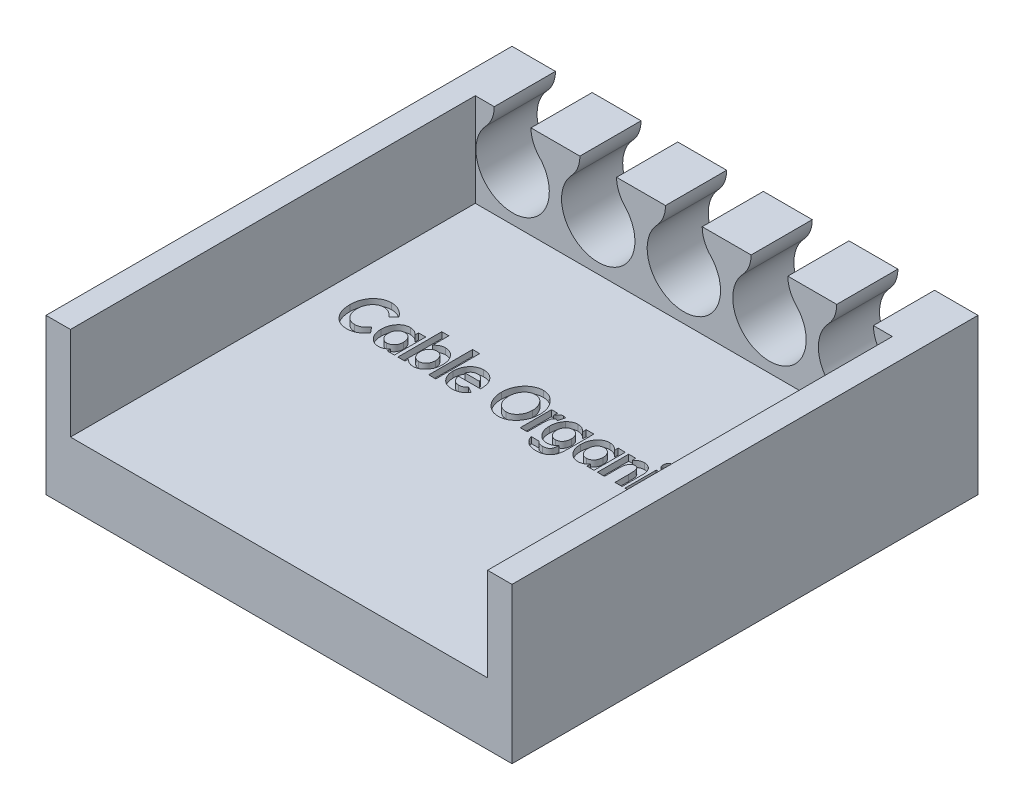
from build123d import *

# Parameters (mm, degrees)
SKETCH1_W           = 38.1
SKETCH1_H           = 38.1
BOSS_EXTRUDE1_DEPTH = 12.7
SKETCH2_W           = 34.1
SKETCH2_H           = 33.1
CUT_EXTRUDE1_DEPTH  = 7.62
CUT_EXTRUDE2_DEPTH  = 45.45
SKETCH5_W           = 0.583333333
SKETCH5_H           = 2.557692308
SKETCH5_W_2         = 0.583333334
SKETCH5_H_2         = 3.58974359
CUT_EXTRUDE3_DEPTH  = 0.5


with BuildPart() as part:
    # Sketch1 → Boss-Extrude1 (new body)
    with BuildSketch(Plane(origin=(0, 0, 0), x_dir=(1, 0, 0), z_dir=(0, 1, 0))):
        Rectangle(SKETCH1_W, SKETCH1_H)
    extrude(amount=BOSS_EXTRUDE1_DEPTH)

    # Sketch2 → Cut-Extrude1 (cut)
    with BuildSketch(Plane(origin=(0, 12.7, 0), x_dir=(1, 0, 0), z_dir=(0, 1, 0))):
        with Locations((0, -2.5)):
            Rectangle(SKETCH2_W, SKETCH2_H)
    extrude(amount=-CUT_EXTRUDE1_DEPTH, mode=Mode.SUBTRACT)

    # Sketch3 → Cut-Extrude2 (cut, through all)
    with BuildSketch(Plane(origin=(0, 0, -19.05), x_dir=(-1, 0, 0), z_dir=(0, 0, -1))):
        with BuildLine():
            Line((-12.5, 12.7), (-15.5, 12.7))
            ThreePointArc((-15.5, 12.7), (-15.676699057, 11.776813818), (-16.181818182, 10.984128537))
            ThreePointArc((-16.181818182, 10.984128537), (-14, 5.925082782), (-11.818181818, 10.984128537))
            ThreePointArc((-11.818181818, 10.984128537), (-12.323300943, 11.776813818), (-12.5, 12.7))
        make_face()
        with BuildLine():
            Line((-5.5, 12.7), (-8.5, 12.7))
            ThreePointArc((-8.5, 12.7), (-8.676699057, 11.776813818), (-9.181818182, 10.984128537))
            ThreePointArc((-9.181818182, 10.984128537), (-7, 5.925082782), (-4.818181818, 10.984128537))
            ThreePointArc((-4.818181818, 10.984128537), (-5.323300943, 11.776813818), (-5.5, 12.7))
        make_face()
        with BuildLine():
            Line((1.5, 12.7), (-1.5, 12.7))
            ThreePointArc((-1.5, 12.7), (-1.676699057, 11.776813818), (-2.181818182, 10.984128537))
            ThreePointArc((-2.181818182, 10.984128537), (0, 5.925082782), (2.181818182, 10.984128537))
            ThreePointArc((2.181818182, 10.984128537), (1.676699057, 11.776813818), (1.5, 12.7))
        make_face()
        with BuildLine():
            Line((8.5, 12.7), (5.5, 12.7))
            ThreePointArc((5.5, 12.7), (5.323300943, 11.776813818), (4.818181818, 10.984128537))
            ThreePointArc((4.818181818, 10.984128537), (7, 5.925082782), (9.181818182, 10.984128537))
            ThreePointArc((9.181818182, 10.984128537), (8.676699057, 11.776813818), (8.5, 12.7))
        make_face()
        with BuildLine():
            Line((15.5, 12.7), (12.5, 12.7))
            ThreePointArc((12.5, 12.7), (12.323300943, 11.776813818), (11.818181818, 10.984128537))
            ThreePointArc((11.818181818, 10.984128537), (14, 5.925082782), (16.181818182, 10.984128537))
            ThreePointArc((16.181818182, 10.984128537), (15.676699057, 11.776813818), (15.5, 12.7))
        make_face()
    extrude(amount=-CUT_EXTRUDE2_DEPTH, mode=Mode.SUBTRACT)

    # Sketch5 → Cut-Extrude3 (cut)
    # profile 1 of 15: a face of its own
    with BuildSketch(Plane(origin=(0, 5.08, 0), x_dir=(1, 0, 0), z_dir=(0, 1, 0))):
        with BuildLine():
            Line((14.152564103, 2.557692308), (14.646153846, 2.557692308))
            Line((14.646153846, 2.557692308), (14.646153846, 2.242888622))
            add(Edge.make_bspline(
                [(14.646153846, 2.242888622), (14.658613366, 2.270776787), (14.682771924, 2.324850931), (14.728104475, 2.398226909), (14.780941779, 2.459954943), (14.838304238, 2.511823555), (14.900935361, 2.551670884), (14.966451445, 2.581153541), (15.035210984, 2.599566042), (15.082374036, 2.601560965), (15.106089744, 2.602564103)],
                knots=[0, 0, 0, 0, 1.180486374, 2.288920328, 3.321190806, 4.31343609, 5.268644312, 6.178971452, 7.084304791, 8, 8, 8, 8], degree=3))
            add(Edge.make_bspline(
                [(15.106089744, 2.602564103), (15.123190102, 2.601563983), (15.158422681, 2.599503396), (15.211867753, 2.58845068), (15.265706947, 2.567008709), (15.300921398, 2.548885899), (15.319230769, 2.539463141)],
                knots=[0, 0, 0, 0, 0.914550222, 1.884285875, 2.89995737, 4, 4, 4, 4], degree=3))
            Line((15.319230769, 2.539463141), (15.160777244, 2.007311699))
            add(Edge.make_bspline(
                [(15.160777244, 2.007311699), (15.146634654, 2.015697468), (15.120258263, 2.0313372), (15.081727865, 2.050196002), (15.046429046, 2.061552482), (15.023887476, 2.063300352), (15.013541667, 2.064102564)],
                knots=[0, 0, 0, 0, 1.235726954, 2.304671084, 3.221902069, 4, 4, 4, 4], degree=3))
            add(Edge.make_bspline(
                [(15.013541667, 2.064102564), (15.00390028, 2.063568279), (14.984708841, 2.06250477), (14.956435696, 2.053596166), (14.929974307, 2.038482779), (14.904016978, 2.018378617), (14.879753206, 1.992155276), (14.856316455, 1.960242841), (14.835312339, 1.922110204), (14.813223348, 1.87873567), (14.794376759, 1.826261506), (14.77774153, 1.763670458), (14.764030496, 1.689817659), (14.753304488, 1.605038333), (14.744063521, 1.509427001), (14.73800753, 1.402779141), (14.734708985, 1.285177618), (14.734107571, 1.203127169), (14.733794071, 1.160356571)],
                knots=[0, 0, 0, 0, 0.455527623, 0.906739907, 1.386837439, 1.891156593, 2.454351582, 3.071419688, 3.759947832, 4.511643037, 5.372316535, 6.391627287, 7.573584895, 8.923241252, 10.433974521, 12.117723503, 13.97627815, 16, 16, 16, 16], degree=3))
            Line((14.733794071, 1.160356571), (14.735897436, 1.035556891))
            Line((14.735897436, 1.035556891), (14.735897436, 0))
            Line((14.735897436, 0), (14.152564103, 0))
            Line((14.152564103, 0), (14.152564103, 2.557692308))
        make_face()
    # profile 2 of 15: a face of its own
    with BuildSketch(Plane(origin=(0, 5.08, 0), x_dir=(1, 0, 0), z_dir=(0, 1, 0))):
        with BuildLine():
            Line((14.051742788, 1.121794872), (12.258974359, 1.121794872))
            add(Edge.make_bspline(
                [(12.258974359, 1.121794872), (12.262582744, 1.098351638), (12.269668242, 1.052318023), (12.286320639, 0.985736151), (12.305227652, 0.922271428), (12.330403355, 0.863344923), (12.358169238, 0.807474429), (12.390772016, 0.755709041), (12.426241894, 0.70666224), (12.467255733, 0.662814468), (12.511038078, 0.622760659), (12.55828654, 0.588197746), (12.608634728, 0.559133271), (12.661875611, 0.535602854), (12.717780928, 0.516144485), (12.776832792, 0.503060474), (12.838828245, 0.495304411), (12.881080467, 0.494168426), (12.902604167, 0.493589744)],
                knots=[0, 0, 0, 0, 1.146849527, 2.251977253, 3.317650667, 4.346522431, 5.347687258, 6.332827264, 7.302930075, 8.271120312, 9.231688711, 10.170178318, 11.097155642, 12.038501321, 12.982423619, 13.956143407, 14.958839262, 16, 16, 16, 16], degree=3))
            add(Edge.make_bspline(
                [(12.902604167, 0.493589744), (12.928608433, 0.494334008), (12.97976438, 0.495798136), (13.054866888, 0.509355618), (13.127506592, 0.528920212), (13.19664155, 0.559423176), (13.263682591, 0.596445682), (13.327649583, 0.64232572), (13.388482012, 0.696912376), (13.425548583, 0.738151037), (13.444571314, 0.759314904)],
                knots=[0, 0, 0, 0, 0.999153581, 1.965548511, 2.927334551, 3.885670452, 4.863451259, 5.868610658, 6.906161375, 8, 8, 8, 8], degree=3))
            Line((13.444571314, 0.759314904), (13.919230769, 0.509014423))
            add(Edge.make_bspline(
                [(13.919230769, 0.509014423), (13.904054427, 0.486169484), (13.874105683, 0.441087658), (13.825450334, 0.377349232), (13.775253533, 0.31735049), (13.721849302, 0.262992535), (13.666819847, 0.212646693), (13.609425329, 0.16683094), (13.54892901, 0.126630833), (13.487114996, 0.0894822), (13.42220472, 0.058012179), (13.354601162, 0.030841902), (13.284409676, 0.006454272), (13.210866652, -0.011936667), (13.134599166, -0.026925755), (13.055211361, -0.037260299), (12.972823553, -0.043690214), (12.916872268, -0.04447499), (12.888581731, -0.044871795)],
                knots=[0, 0, 0, 0, 1.071852362, 2.11517579, 3.132865197, 4.127787591, 5.091387768, 6.047335373, 6.99499635, 7.928816936, 8.864467975, 9.811115575, 10.776057363, 11.766523666, 12.77166992, 13.813071645, 14.894227783, 16, 16, 16, 16], degree=3))
            add(Edge.make_bspline(
                [(12.888581731, -0.044871795), (12.844816751, -0.043896875), (12.759022696, -0.041985706), (12.63333466, -0.023924286), (12.513963754, 0.005306764), (12.400616844, 0.046323291), (12.293570554, 0.098798822), (12.193490461, 0.164310585), (12.098854384, 0.240187217), (12.012074765, 0.327728863), (11.932934335, 0.423301432), (11.863910031, 0.526194287), (11.805595218, 0.634912741), (11.758452067, 0.749697929), (11.721099359, 0.87000737), (11.694505062, 0.99649404), (11.679102883, 1.128892119), (11.676808629, 1.218977169), (11.675641026, 1.264823718)],
                knots=[0, 0, 0, 0, 1.049755589, 2.057873404, 3.039992, 3.994498303, 4.945124516, 5.894078242, 6.859333238, 7.850791742, 8.846808408, 9.833018117, 10.819132135, 11.80235509, 12.806424065, 13.838211831, 14.899811597, 16, 16, 16, 16], degree=3))
            add(Edge.make_bspline(
                [(11.675641026, 1.264823718), (11.676421355, 1.311851244), (11.677955799, 1.404326515), (11.694825714, 1.539563581), (11.720407525, 1.668909848), (11.757091025, 1.792099895), (11.803747806, 1.909496348), (11.862074669, 2.020115271), (11.929255099, 2.125422561), (12.007597604, 2.222662587), (12.09338068, 2.31151721), (12.185131434, 2.389720844), (12.282696889, 2.455679167), (12.3857347, 2.50888289), (12.493526698, 2.551869382), (12.607205257, 2.580528323), (12.725723027, 2.599927134), (12.806703434, 2.601674711), (12.847916667, 2.602564103)],
                knots=[0, 0, 0, 0, 1.135168558, 2.232203781, 3.285989536, 4.316404679, 5.332012648, 6.33173434, 7.332156831, 8.34408818, 9.341975913, 10.311100388, 11.250360963, 12.179373606, 13.106962079, 14.046086977, 15.005598096, 16, 16, 16, 16], degree=3))
            add(Edge.make_bspline(
                [(12.847916667, 2.602564103), (12.891680269, 2.601594113), (12.977240093, 2.599697739), (13.102495599, 2.58167343), (13.221263669, 2.552128925), (13.33444416, 2.511977434), (13.439903624, 2.457430295), (13.540659602, 2.39387717), (13.633802431, 2.316576287), (13.720724386, 2.229211342), (13.798792443, 2.132045911), (13.867444265, 2.026971904), (13.924891067, 1.913946753), (13.972856572, 1.793950473), (14.009261234, 1.666076397), (14.034692475, 1.530883438), (14.051602253, 1.388181025), (14.05308658, 1.290348338), (14.053846154, 1.240284455)],
                knots=[0, 0, 0, 0, 1.026481151, 2.006817104, 2.961837659, 3.895181324, 4.81737322, 5.742316888, 6.685373961, 7.650980429, 8.629950187, 9.604994969, 10.590990312, 11.600214974, 12.633005622, 13.705343145, 14.825756126, 16, 16, 16, 16], degree=3))
            Line((14.053846154, 1.240284455), (14.051742788, 1.121794872))
        make_face()
        with BuildLine():
            add(Edge.make_bspline(
                [(13.470512821, 1.615384615), (13.460549818, 1.647336737), (13.440857915, 1.710490197), (13.393865484, 1.797239789), (13.333682857, 1.874441201), (13.261925894, 1.941096782), (13.180657973, 1.996336737), (13.091412524, 2.03586516), (12.995706775, 2.059915665), (12.9298543, 2.06268913), (12.896294071, 2.064102564)],
                knots=[0, 0, 0, 0, 1.021734253, 2.019460652, 2.997405089, 4.003798667, 5.002932207, 5.988474262, 6.974871272, 8, 8, 8, 8], degree=3))
            add(Edge.make_bspline(
                [(12.896294071, 2.064102564), (12.859632709, 2.062738099), (12.787848092, 2.060066415), (12.684515684, 2.031447679), (12.586872649, 1.988672317), (12.530262038, 1.945675859), (12.5015625, 1.923878205)],
                knots=[0, 0, 0, 0, 1.026795621, 2.010512614, 2.991401663, 4, 4, 4, 4], degree=3))
            add(Edge.make_bspline(
                [(12.5015625, 1.923878205), (12.483371169, 1.90717151), (12.444285523, 1.871275733), (12.395808347, 1.799881718), (12.34608895, 1.714675493), (12.318524679, 1.649886204), (12.303846154, 1.615384615)],
                knots=[0, 0, 0, 0, 0.799314424, 1.71739603, 2.784467849, 4, 4, 4, 4], degree=3))
            Line((12.303846154, 1.615384615), (13.470512821, 1.615384615))
        make_face(mode=Mode.SUBTRACT)
    # profile 3 of 15: a face of its own
    with BuildSketch(Plane(origin=(0, 5.08, 0), x_dir=(1, 0, 0), z_dir=(0, 1, 0))):
        Polygon((9.961538462, 2.557692308), (11.711538462, 2.557692308), (10.725060096, 0.538461538), (11.621794872, 0.538461538), (11.621794872, 0), (9.826923077, 0), (10.812700321, 2.019230769), (9.961538462, 2.019230769), align=None)
    # profile 4 of 15: a face of its own
    with BuildSketch(Plane(origin=(0, 5.08, 0), x_dir=(1, 0, 0), z_dir=(0, 1, 0))):
        with BuildLine():
            add(Edge.make_bspline(
                [(9.524879808, 3.634615385), (9.550316922, 3.63323371), (9.600724974, 3.630495682), (9.672891665, 3.605364363), (9.738820787, 3.56494353), (9.79702258, 3.51024824), (9.845633877, 3.444918616), (9.882406108, 3.371592747), (9.903871487, 3.290861571), (9.906399355, 3.234869015), (9.907692308, 3.206229968)],
                knots=[0, 0, 0, 0, 0.955496337, 1.893481667, 2.841448686, 3.85038073, 4.881940447, 5.893556336, 6.922597162, 8, 8, 8, 8], degree=3))
            add(Edge.make_bspline(
                [(9.907692308, 3.206229968), (9.906473427, 3.177793776), (9.904100217, 3.122427351), (9.8817288, 3.04300386), (9.84757322, 2.96935211), (9.798299261, 2.905229596), (9.740771019, 2.851086838), (9.676046734, 2.810584887), (9.604606169, 2.786281565), (9.554977646, 2.783475539), (9.52978766, 2.782051282)],
                knots=[0, 0, 0, 0, 1.080611883, 2.103995402, 3.119179752, 4.155180067, 5.16284559, 6.113849421, 7.042645142, 8, 8, 8, 8], degree=3))
            add(Edge.make_bspline(
                [(9.52978766, 2.782051282), (9.503870314, 2.7833779), (9.452968566, 2.785983382), (9.380253275, 2.811487612), (9.313547155, 2.851661873), (9.254932306, 2.907004668), (9.205853353, 2.973129071), (9.170493265, 3.047946826), (9.148549226, 3.129508596), (9.146119405, 3.186223721), (9.144871795, 3.215344551)],
                knots=[0, 0, 0, 0, 0.963066972, 1.891466541, 2.837198163, 3.848131276, 4.876149276, 5.889294623, 6.916241597, 8, 8, 8, 8], degree=3))
            add(Edge.make_bspline(
                [(9.144871795, 3.215344551), (9.14614474, 3.243301498), (9.148643337, 3.298176699), (9.17052847, 3.376840493), (9.205232375, 3.44959371), (9.254527591, 3.513054026), (9.312021251, 3.567014274), (9.377808722, 3.606015023), (9.449341383, 3.63044282), (9.499446179, 3.633210491), (9.524879808, 3.634615385)],
                knots=[0, 0, 0, 0, 1.066370917, 2.093122674, 3.09555033, 4.127839891, 5.145386425, 6.090282709, 7.030610982, 8, 8, 8, 8], degree=3))
        make_face()
    # profile 5 of 15: a face of its own
    with BuildSketch(Plane(origin=(0, 5.08, 0), x_dir=(1, 0, 0), z_dir=(0, 1, 0))):
        with Locations((9.526282052, 1.278846154)):
            Rectangle(SKETCH5_W, SKETCH5_H)
    # profile 6 of 15: a face of its own
    with BuildSketch(Plane(origin=(0, 5.08, 0), x_dir=(1, 0, 0), z_dir=(0, 1, 0))):
        with BuildLine():
            Line((6.982051282, 2.557692308), (7.565384615, 2.557692308))
            Line((7.565384615, 2.557692308), (7.565384615, 2.287059295))
            add(Edge.make_bspline(
                [(7.565384615, 2.287059295), (7.596296821, 2.314886146), (7.655117003, 2.367835472), (7.745217022, 2.435825036), (7.83009538, 2.491475637), (7.911900295, 2.533746124), (7.992234881, 2.564522114), (8.072338028, 2.586171495), (8.153359669, 2.600319705), (8.207788667, 2.601816836), (8.234955929, 2.602564103)],
                knots=[0, 0, 0, 0, 1.314626485, 2.501489937, 3.565380844, 4.520562704, 5.407158137, 6.280221707, 7.14160339, 8, 8, 8, 8], degree=3))
            add(Edge.make_bspline(
                [(8.234955929, 2.602564103), (8.262333985, 2.601688402), (8.316416559, 2.599958545), (8.396097538, 2.588241307), (8.472249336, 2.566574424), (8.545669719, 2.538141781), (8.615328955, 2.500236739), (8.682613174, 2.455439532), (8.745768979, 2.40091658), (8.784521452, 2.359861116), (8.804266827, 2.338942308)],
                knots=[0, 0, 0, 0, 1.014719459, 2.004475462, 2.97532913, 3.943590705, 4.916220021, 5.908360753, 6.934256359, 8, 8, 8, 8], degree=3))
            add(Edge.make_bspline(
                [(8.804266827, 2.338942308), (8.820185545, 2.319435332), (8.852365679, 2.280001432), (8.892134552, 2.213285072), (8.925846195, 2.140353502), (8.954191103, 2.060939876), (8.974670254, 1.974071838), (8.989833621, 1.880824297), (9.000181776, 1.781078978), (9.000908396, 1.712400439), (9.001282051, 1.677083333)],
                knots=[0, 0, 0, 0, 0.855609331, 1.729638263, 2.63311309, 3.58616324, 4.592760388, 5.664565428, 6.799031124, 8, 8, 8, 8], degree=3))
            Line((9.001282051, 1.677083333), (9.001282051, 0))
            Line((9.001282051, 0), (8.417948718, 0))
            Line((8.417948718, 0), (8.417948718, 1.110576923))
            add(Edge.make_bspline(
                [(8.417948718, 1.110576923), (8.417758669, 1.146801881), (8.417394498, 1.216216174), (8.416185036, 1.315554026), (8.413548231, 1.405324437), (8.409101518, 1.485470894), (8.404678977, 1.556128125), (8.39818335, 1.61711242), (8.391620991, 1.668678286), (8.380711219, 1.723569182), (8.36309618, 1.782321353), (8.336271207, 1.844498955), (8.302089803, 1.897763191), (8.261112962, 1.941539464), (8.214317544, 1.976741418), (8.161542823, 2.001366931), (8.103761446, 2.016646911), (8.063511762, 2.018354259), (8.042848558, 2.019230769)],
                knots=[0, 0, 0, 0, 1.57704623, 3.021937291, 4.324880877, 5.486354158, 6.516421506, 7.40630757, 8.155966311, 8.778512542, 9.840738566, 10.82006257, 11.717477906, 12.581273684, 13.417609407, 14.250472269, 15.101835209, 16, 16, 16, 16], degree=3))
            add(Edge.make_bspline(
                [(8.042848558, 2.019230769), (8.015792564, 2.017581195), (7.96268795, 2.014343464), (7.886054471, 1.989435633), (7.816192266, 1.947494464), (7.753083889, 1.889995473), (7.697807351, 1.818637295), (7.651355941, 1.734645333), (7.613931119, 1.638391325), (7.597692161, 1.568896937), (7.589222756, 1.532652244)],
                knots=[0, 0, 0, 0, 0.897699891, 1.76197581, 2.646110054, 3.586187227, 4.581727957, 5.631439097, 6.764680622, 8, 8, 8, 8], degree=3))
            add(Edge.make_bspline(
                [(7.589222756, 1.532652244), (7.587238106, 1.521217025), (7.582799051, 1.495639942), (7.578296256, 1.452783213), (7.573871178, 1.401612929), (7.571654604, 1.341711913), (7.568574255, 1.273024851), (7.566405244, 1.195659323), (7.566149448, 1.109641147), (7.565648014, 1.04957894), (7.565384615, 1.018028846)],
                knots=[0, 0, 0, 0, 0.540013235, 1.207844301, 2.004518598, 2.930058647, 3.996859805, 5.204611014, 6.5316093, 8, 8, 8, 8], degree=3))
            Line((7.565384615, 1.018028846), (7.565384615, 0))
            Line((7.565384615, 0), (6.982051282, 0))
            Line((6.982051282, 0), (6.982051282, 2.557692308))
        make_face()
    # profile 7 of 15: a face of its own
    with BuildSketch(Plane(origin=(0, 5.08, 0), x_dir=(1, 0, 0), z_dir=(0, 1, 0))):
        with BuildLine():
            Line((6.120512821, 2.557692308), (6.703846154, 2.557692308))
            Line((6.703846154, 2.557692308), (6.703846154, 0))
            Line((6.703846154, 0), (6.120512821, 0))
            Line((6.120512821, 0), (6.120512821, 0.279046474))
            add(Edge.make_bspline(
                [(6.120512821, 0.279046474), (6.09289857, 0.251936021), (6.039541255, 0.199552162), (5.954972689, 0.131025931), (5.870133931, 0.074831099), (5.784935626, 0.029363721), (5.697316016, -0.003601649), (5.606977197, -0.027826849), (5.512847627, -0.04189657), (5.448883392, -0.043873568), (5.416586538, -0.044871795)],
                knots=[0, 0, 0, 0, 1.163382011, 2.247931421, 3.267489461, 4.220113468, 5.145617393, 6.076497093, 7.028783948, 8, 8, 8, 8], degree=3))
            add(Edge.make_bspline(
                [(5.416586538, -0.044871795), (5.380040721, -0.043964195), (5.307877521, -0.042172052), (5.201919705, -0.022741836), (5.099645123, 0.006297639), (5.001347302, 0.048254434), (4.907142176, 0.102096992), (4.815852645, 0.166963316), (4.729236786, 0.244593467), (4.64688246, 0.332390136), (4.571893249, 0.429160381), (4.505287924, 0.532545453), (4.450070587, 0.642537643), (4.404257962, 0.757647666), (4.36910098, 0.878605326), (4.344108983, 1.005283548), (4.328172784, 1.137747974), (4.326493419, 1.22808572), (4.325641026, 1.273938301)],
                knots=[0, 0, 0, 0, 0.921835666, 1.820252405, 2.711136546, 3.602274754, 4.511404282, 5.446462619, 6.424679939, 7.443427837, 8.482233586, 9.511947504, 10.543891267, 11.584974293, 12.636376529, 13.719674099, 14.842578722, 16, 16, 16, 16], degree=3))
            add(Edge.make_bspline(
                [(4.325641026, 1.273938301), (4.326540583, 1.321421346), (4.328304323, 1.414520247), (4.34340961, 1.550945944), (4.3675607, 1.68093992), (4.402143911, 1.803995776), (4.44556246, 1.920912195), (4.499812609, 2.030765603), (4.562837443, 2.134881378), (4.636708309, 2.230111728), (4.716297564, 2.317344334), (4.801390093, 2.39340584), (4.890502106, 2.458087378), (4.984014875, 2.51103822), (5.08228498, 2.55187457), (5.184293808, 2.581416205), (5.290664989, 2.599655735), (5.362994463, 2.601583976), (5.399759615, 2.602564103)],
                knots=[0, 0, 0, 0, 1.196863731, 2.346662879, 3.456089904, 4.526915168, 5.565529373, 6.595904008, 7.611531943, 8.628611739, 9.629449148, 10.585123154, 11.500947365, 12.400650051, 13.288132989, 14.177647946, 15.073696393, 16, 16, 16, 16], degree=3))
            add(Edge.make_bspline(
                [(5.399759615, 2.602564103), (5.433720743, 2.601778695), (5.500872822, 2.600225691), (5.599487989, 2.583073994), (5.695072936, 2.557405259), (5.787146136, 2.520262092), (5.87690552, 2.474439312), (5.961674213, 2.415643693), (6.04479302, 2.348654287), (6.094892885, 2.296302677), (6.120512821, 2.26953125)],
                knots=[0, 0, 0, 0, 0.995162038, 1.96775565, 2.927337147, 3.893531728, 4.874688255, 5.876697576, 6.914191259, 8, 8, 8, 8], degree=3))
            Line((6.120512821, 2.26953125), (6.120512821, 2.557692308))
        make_face()
        with BuildLine():
            add(Edge.make_bspline(
                [(5.531570513, 2.019230769), (5.509810349, 2.018439085), (5.466804097, 2.016874421), (5.40366384, 2.008032621), (5.34318091, 1.99165557), (5.286014723, 1.968357049), (5.231094752, 1.939573458), (5.179863959, 1.90310507), (5.13063272, 1.861271146), (5.08532513, 1.812820646), (5.044289994, 1.759624058), (5.007123074, 1.702897354), (4.977696091, 1.641420796), (4.951533655, 1.577375449), (4.933297935, 1.508928679), (4.918967844, 1.437089608), (4.910560334, 1.361543531), (4.909508429, 1.309949279), (4.908974359, 1.283754006)],
                knots=[0, 0, 0, 0, 0.969811408, 1.916711318, 2.833650388, 3.754071331, 4.662456234, 5.589743238, 6.549778185, 7.536877355, 8.538750444, 9.541056354, 10.551604298, 11.570646859, 12.619111342, 13.70146669, 14.832995853, 16, 16, 16, 16], degree=3))
            add(Edge.make_bspline(
                [(4.908974359, 1.283754006), (4.909500897, 1.257322814), (4.910538083, 1.20525806), (4.919055561, 1.129047926), (4.933008296, 1.056325229), (4.952709973, 0.987348188), (4.977824217, 0.921639523), (5.00954971, 0.860111206), (5.046450432, 0.801970678), (5.087915668, 0.747707749), (5.134175019, 0.698846891), (5.183169618, 0.6556666), (5.235556482, 0.61967092), (5.290393582, 0.590218972), (5.347374186, 0.566690326), (5.407227822, 0.550585304), (5.469535017, 0.540580725), (5.512135186, 0.53917319), (5.533673878, 0.538461538)],
                knots=[0, 0, 0, 0, 1.168729735, 2.302189922, 3.386710167, 4.440198422, 5.470978749, 6.492597328, 7.496227051, 8.513391371, 9.50782408, 10.467539671, 11.396482034, 12.312160972, 13.216215124, 14.11642033, 15.047660069, 16, 16, 16, 16], degree=3))
            add(Edge.make_bspline(
                [(5.533673878, 0.538461538), (5.555903091, 0.539238074), (5.599611999, 0.540764961), (5.663884251, 0.549760502), (5.725344778, 0.565915295), (5.78347809, 0.589259394), (5.838871928, 0.618450968), (5.891799574, 0.653295136), (5.940855147, 0.696048695), (5.987128706, 0.744180895), (6.028756551, 0.797875482), (6.065613035, 0.855738445), (6.096540515, 0.917798559), (6.121671816, 0.983838506), (6.141438219, 1.053746927), (6.15528604, 1.12765745), (6.163849967, 1.205493513), (6.164866486, 1.258724839), (6.165384615, 1.285857372)],
                knots=[0, 0, 0, 0, 0.973494368, 1.914164832, 2.835034228, 3.749055219, 4.650792206, 5.573195486, 6.516644894, 7.49373616, 8.49266101, 9.486277843, 10.493086248, 11.523132543, 12.575953654, 13.669751989, 14.812249585, 16, 16, 16, 16], degree=3))
            add(Edge.make_bspline(
                [(6.165384615, 1.285857372), (6.164875669, 1.312523302), (6.163881895, 1.364591523), (6.15525398, 1.440795462), (6.141302744, 1.513266196), (6.121956624, 1.581916928), (6.096378077, 1.646414932), (6.065403638, 1.706993112), (6.028989111, 1.763998466), (5.986859223, 1.816361702), (5.940903594, 1.863833804), (5.891568152, 1.905766496), (5.838730951, 1.940768176), (5.783227974, 1.970012558), (5.724325545, 1.991400473), (5.663004997, 2.008130294), (5.598192504, 2.016882328), (5.554028296, 2.018439127), (5.531570513, 2.019230769)],
                knots=[0, 0, 0, 0, 1.177928123, 2.300036839, 3.38351634, 4.435993631, 5.446552242, 6.444100992, 7.438062291, 8.429875644, 9.408429948, 10.353784422, 11.284588866, 12.203691864, 13.118608642, 14.047865231, 15.007326911, 16, 16, 16, 16], degree=3))
        make_face(mode=Mode.SUBTRACT)
    # profile 8 of 15: a face of its own
    with BuildSketch(Plane(origin=(0, 5.08, 0), x_dir=(1, 0, 0), z_dir=(0, 1, 0))):
        with BuildLine():
            Line((3.508974359, 2.557692308), (4.137179487, 2.557692308))
            Line((4.137179487, 2.557692308), (4.137179487, 0.375801282))
            add(Edge.make_bspline(
                [(4.137179487, 0.375801282), (4.136637494, 0.32365937), (4.135591021, 0.222984498), (4.123895705, 0.077195259), (4.106462906, -0.058071109), (4.0803842, -0.182680734), (4.047918392, -0.296610088), (4.00766444, -0.399895004), (3.960985145, -0.493402469), (3.921493193, -0.548262751), (3.902303686, -0.574919872)],
                knots=[0, 0, 0, 0, 1.256223038, 2.425497804, 3.522267765, 4.540655939, 5.490641019, 6.373336975, 7.209589328, 8, 8, 8, 8], degree=3))
            add(Edge.make_bspline(
                [(3.902303686, -0.574919872), (3.875076947, -0.607927821), (3.821280226, -0.673147507), (3.726328624, -0.757585373), (3.621313648, -0.828281926), (3.506699566, -0.887365514), (3.381792403, -0.931762558), (3.247162493, -0.96405818), (3.102684, -0.983961871), (3.002829635, -0.986088211), (2.951582532, -0.987179487)],
                knots=[0, 0, 0, 0, 0.953628982, 1.884254705, 2.822910234, 3.772094901, 4.753560911, 5.772956964, 6.857040417, 8, 8, 8, 8], degree=3))
            add(Edge.make_bspline(
                [(2.951582532, -0.987179487), (2.897311577, -0.986245844), (2.792902043, -0.984449648), (2.642902885, -0.966842592), (2.506339626, -0.937905818), (2.38260012, -0.897002846), (2.270443331, -0.844565485), (2.167883997, -0.780949627), (2.074285538, -0.706288373), (1.989621934, -0.621039716), (1.915037411, -0.52521223), (1.851066383, -0.419242679), (1.797235022, -0.303523473), (1.770512262, -0.221405999), (1.756870994, -0.179487179)],
                knots=[0, 0, 0, 0, 1.248476706, 2.401890129, 3.46942611, 4.455847326, 5.394179775, 6.312020615, 7.226704641, 8.143220943, 9.070576915, 10.014150498, 10.986275854, 12, 12, 12, 12], degree=3))
            Line((1.756870994, -0.179487179), (2.375961538, -0.179487179))
            add(Edge.make_bspline(
                [(2.375961538, -0.179487179), (2.390256345, -0.197168166), (2.418709853, -0.232361796), (2.469096722, -0.278315554), (2.525609336, -0.316956553), (2.587998537, -0.348923949), (2.656518288, -0.373031348), (2.730367259, -0.391567375), (2.810362178, -0.401955563), (2.865549092, -0.403201686), (2.894090545, -0.403846154)],
                knots=[0, 0, 0, 0, 0.92916766, 1.849488492, 2.777671865, 3.722642166, 4.708561612, 5.742761757, 6.832606255, 8, 8, 8, 8], degree=3))
            add(Edge.make_bspline(
                [(2.894090545, -0.403846154), (2.930158101, -0.403122501), (2.998689283, -0.401747503), (3.09572566, -0.385614224), (3.182403191, -0.362205461), (3.257378569, -0.326449529), (3.321900085, -0.283403037), (3.376191343, -0.234185847), (3.420952036, -0.179485973), (3.448765592, -0.127889037), (3.46681279, -0.081989687), (3.477362398, -0.041388495), (3.487345259, 0.004662917), (3.495659512, 0.056369169), (3.501882845, 0.11393739), (3.505766141, 0.177343142), (3.508814165, 0.246298156), (3.508919773, 0.294233544), (3.508974359, 0.319010417)],
                knots=[0, 0, 0, 0, 1.561625808, 2.967211325, 4.252919363, 5.440158513, 6.549933366, 7.604082958, 8.605516233, 9.598304768, 10.130682529, 10.740166591, 11.413714242, 12.173124092, 13.008769697, 13.922490553, 14.926175623, 16, 16, 16, 16], degree=3))
            add(Edge.make_bspline(
                [(3.508974359, 0.319010417), (3.484442049, 0.292138995), (3.437012683, 0.240187324), (3.360335464, 0.172207505), (3.281059346, 0.117089195), (3.199717743, 0.072600653), (3.114114697, 0.040311043), (3.024339647, 0.017089561), (2.929133831, 0.002799354), (2.863758851, 0.000947899), (2.830288462, 0)],
                knots=[0, 0, 0, 0, 1.124250012, 2.173560744, 3.15956066, 4.103399407, 5.031823069, 5.97977238, 6.965692896, 8, 8, 8, 8], degree=3))
            add(Edge.make_bspline(
                [(2.830288462, 0), (2.793523178, 0.000994188), (2.720731988, 0.002962572), (2.613978352, 0.021163716), (2.511610837, 0.049788269), (2.41371352, 0.090293062), (2.320376794, 0.142359845), (2.231255817, 0.206099462), (2.147118149, 0.281749813), (2.067591789, 0.367490558), (1.995345338, 0.462133986), (1.931520027, 0.563777451), (1.87836118, 0.672005747), (1.835034796, 0.786206855), (1.799934191, 0.906068396), (1.777056154, 1.032533919), (1.761553287, 1.164880375), (1.759845723, 1.255194866), (1.758974359, 1.301282051)],
                knots=[0, 0, 0, 0, 0.938749832, 1.858620681, 2.758444436, 3.650047179, 4.558920363, 5.483566379, 6.44364989, 7.445109419, 8.467483578, 9.481522549, 10.507031016, 11.542849837, 12.599341913, 13.693228332, 14.822862054, 16, 16, 16, 16], degree=3))
            add(Edge.make_bspline(
                [(1.758974359, 1.301282051), (1.759819429, 1.350401834), (1.761469736, 1.446326045), (1.777189995, 1.586578651), (1.803165951, 1.719482893), (1.838433058, 1.845288241), (1.885052179, 1.963430961), (1.942324991, 2.073739972), (2.008406581, 2.177962632), (2.061341323, 2.240417081), (2.087800481, 2.271634615)],
                knots=[0, 0, 0, 0, 1.124207849, 2.195424024, 3.225844771, 4.221680391, 5.182445822, 6.12766617, 7.064123583, 8, 8, 8, 8], degree=3))
            add(Edge.make_bspline(
                [(2.087800481, 2.271634615), (2.112767347, 2.298101866), (2.161652621, 2.349924901), (2.242230856, 2.417334146), (2.326020298, 2.474978198), (2.414100266, 2.520987374), (2.505211309, 2.558295938), (2.600130263, 2.583881407), (2.698622245, 2.600051064), (2.765487452, 2.601717798), (2.799439103, 2.602564103)],
                knots=[0, 0, 0, 0, 1.077655938, 2.110056733, 3.107229324, 4.086410617, 5.0498821, 6.01953444, 6.994393699, 8, 8, 8, 8], degree=3))
            add(Edge.make_bspline(
                [(2.799439103, 2.602564103), (2.831269789, 2.601566105), (2.894306264, 2.599589703), (2.987767051, 2.585407741), (3.078138722, 2.56066599), (3.166477209, 2.526400959), (3.253680697, 2.482069227), (3.33951149, 2.424047114), (3.426135114, 2.354691833), (3.480702535, 2.300904508), (3.508974359, 2.273036859)],
                knots=[0, 0, 0, 0, 0.948490587, 1.878360493, 2.809325316, 3.735431399, 4.697959795, 5.7179186, 6.817635111, 8, 8, 8, 8], degree=3))
            Line((3.508974359, 2.273036859), (3.508974359, 2.557692308))
        make_face()
        with BuildLine():
            add(Edge.make_bspline(
                [(2.948076923, 2.019230769), (2.926548506, 2.018462533), (2.884466003, 2.016960829), (2.822498724, 2.007925346), (2.763864796, 1.991578357), (2.707465724, 1.969748991), (2.654203912, 1.941040049), (2.604304233, 1.905182114), (2.555976586, 1.864809203), (2.512611583, 1.817012569), (2.472584002, 1.765297776), (2.437322226, 1.709808566), (2.407900877, 1.650770939), (2.38402655, 1.588480679), (2.364909407, 1.523117766), (2.351779053, 1.454329274), (2.34400895, 1.382323861), (2.342882805, 1.333319423), (2.342307692, 1.308293269)],
                knots=[0, 0, 0, 0, 0.990166964, 1.935521099, 2.871482541, 3.7835075, 4.711537973, 5.644780747, 6.605284782, 7.601498623, 8.605334893, 9.610091164, 10.619377649, 11.633231065, 12.67395437, 13.746754499, 14.849286535, 16, 16, 16, 16], degree=3))
            add(Edge.make_bspline(
                [(2.342307692, 1.308293269), (2.342804111, 1.282324273), (2.343777306, 1.231413836), (2.352623169, 1.157169935), (2.365497459, 1.086152039), (2.385357416, 1.019190691), (2.409976605, 0.955278284), (2.4400885, 0.895220109), (2.475308508, 0.838295211), (2.516609431, 0.786211439), (2.56182795, 0.738967932), (2.60977555, 0.696853338), (2.660882527, 0.66183668), (2.715116839, 0.633425007), (2.771945954, 0.610929529), (2.831635952, 0.594674336), (2.894281235, 0.585595082), (2.936830717, 0.584098698), (2.95859375, 0.583333333)],
                knots=[0, 0, 0, 0, 1.170935475, 2.295538668, 3.368611052, 4.4228236, 5.440834907, 6.454470003, 7.449012132, 8.454998288, 9.446686792, 10.395770877, 11.328555392, 12.233951526, 13.152085322, 14.080391155, 15.0181664, 16, 16, 16, 16], degree=3))
            add(Edge.make_bspline(
                [(2.95859375, 0.583333333), (2.97967592, 0.583711983), (3.021148333, 0.584456856), (3.081878603, 0.59514799), (3.140136506, 0.610004019), (3.195429358, 0.632068631), (3.247384996, 0.660444991), (3.297236249, 0.694156507), (3.34313944, 0.735324167), (3.386895038, 0.781324047), (3.425568985, 0.833180094), (3.460507351, 0.888677392), (3.488882977, 0.948686449), (3.513201162, 1.012056564), (3.530969863, 1.079611183), (3.544572222, 1.150782614), (3.552099354, 1.225866865), (3.553255975, 1.277194773), (3.553846154, 1.303385417)],
                knots=[0, 0, 0, 0, 0.965684215, 1.899674187, 2.820094575, 3.719808852, 4.621500455, 5.531310999, 6.473141528, 7.443810259, 8.438565243, 9.435051341, 10.446643511, 11.477921589, 12.544041777, 13.645675432, 14.798679376, 16, 16, 16, 16], degree=3))
            add(Edge.make_bspline(
                [(3.553846154, 1.303385417), (3.553266025, 1.329343251), (3.55213448, 1.379974155), (3.544520885, 1.454119508), (3.530942788, 1.524350313), (3.513240129, 1.591553806), (3.48822266, 1.65430011), (3.45956228, 1.713965996), (3.425245508, 1.769632999), (3.384868854, 1.820276841), (3.342307224, 1.867626639), (3.29455734, 1.907488235), (3.24472242, 1.942485903), (3.191134406, 1.970441675), (3.134713956, 1.992441655), (3.07512598, 2.007606484), (3.012715262, 2.01807479), (2.969856351, 2.01884127), (2.948076923, 2.019230769)],
                knots=[0, 0, 0, 0, 1.184959069, 2.311269447, 3.397193377, 4.447961331, 5.47816475, 6.475358928, 7.467116895, 8.455195709, 9.42906183, 10.367515699, 11.287845319, 12.20408484, 13.119392245, 14.045761727, 15.006923168, 16, 16, 16, 16], degree=3))
        make_face(mode=Mode.SUBTRACT)
    # profile 9 of 15: a face of its own
    with BuildSketch(Plane(origin=(0, 5.08, 0), x_dir=(1, 0, 0), z_dir=(0, 1, 0))):
        with BuildLine():
            Line((0.673076923, 2.557692308), (1.166666667, 2.557692308))
            Line((1.166666667, 2.557692308), (1.166666667, 2.242888622))
            add(Edge.make_bspline(
                [(1.166666667, 2.242888622), (1.179126187, 2.270776787), (1.203284744, 2.324850931), (1.248617296, 2.398226909), (1.301454599, 2.459954943), (1.358817058, 2.511823555), (1.421448181, 2.551670884), (1.486964265, 2.581153541), (1.555723805, 2.599566042), (1.602886857, 2.601560965), (1.626602564, 2.602564103)],
                knots=[0, 0, 0, 0, 1.180486374, 2.288920328, 3.321190806, 4.31343609, 5.268644312, 6.178971452, 7.084304791, 8, 8, 8, 8], degree=3))
            add(Edge.make_bspline(
                [(1.626602564, 2.602564103), (1.643702922, 2.601563983), (1.678935501, 2.599503396), (1.732380573, 2.58845068), (1.786219768, 2.567008709), (1.821434218, 2.548885899), (1.83974359, 2.539463141)],
                knots=[0, 0, 0, 0, 0.914550222, 1.884285875, 2.89995737, 4, 4, 4, 4], degree=3))
            Line((1.83974359, 2.539463141), (1.681290064, 2.007311699))
            add(Edge.make_bspline(
                [(1.681290064, 2.007311699), (1.667147474, 2.015697468), (1.640771083, 2.0313372), (1.602240686, 2.050196002), (1.566941867, 2.061552482), (1.544400296, 2.063300352), (1.534054487, 2.064102564)],
                knots=[0, 0, 0, 0, 1.235726954, 2.304671084, 3.221902069, 4, 4, 4, 4], degree=3))
            add(Edge.make_bspline(
                [(1.534054487, 2.064102564), (1.5244131, 2.063568279), (1.505221662, 2.06250477), (1.476948516, 2.053596166), (1.450487128, 2.038482779), (1.424529798, 2.018378617), (1.400266026, 1.992155276), (1.376829275, 1.960242841), (1.35582516, 1.922110204), (1.333736168, 1.87873567), (1.31488958, 1.826261506), (1.29825435, 1.763670458), (1.284543316, 1.689817659), (1.273817309, 1.605038333), (1.264576341, 1.509427001), (1.258520351, 1.402779141), (1.255221805, 1.285177618), (1.254620391, 1.203127169), (1.254306891, 1.160356571)],
                knots=[0, 0, 0, 0, 0.455527623, 0.906739907, 1.386837439, 1.891156593, 2.454351582, 3.071419688, 3.759947832, 4.511643037, 5.372316535, 6.391627287, 7.573584895, 8.923241252, 10.433974521, 12.117723503, 13.97627815, 16, 16, 16, 16], degree=3))
            Line((1.254306891, 1.160356571), (1.256410256, 1.035556891))
            Line((1.256410256, 1.035556891), (1.256410256, 0))
            Line((1.256410256, 0), (0.673076923, 0))
            Line((0.673076923, 0), (0.673076923, 2.557692308))
        make_face()
    # profile 10 of 15: a face of its own
    with BuildSketch(Plane(origin=(0, 5.08, 0), x_dir=(1, 0, 0), z_dir=(0, 1, 0))):
        with BuildLine():
            add(Edge.make_bspline(
                [(-1.034715545, 3.58974359), (-0.982025302, 3.588189043), (-0.87812748, 3.585123694), (-0.725225076, 3.558842354), (-0.577926052, 3.516830655), (-0.436182034, 3.457628973), (-0.300609752, 3.380821567), (-0.17041425, 3.288037577), (-0.046660504, 3.177314508), (0.070630457, 3.052444821), (0.177884424, 2.915174174), (0.272288104, 2.769112333), (0.351594647, 2.615377391), (0.417675331, 2.454973462), (0.466850388, 2.286225161), (0.503525741, 2.110731607), (0.525776408, 1.927488736), (0.528235886, 1.802879743), (0.529487179, 1.739483173)],
                knots=[0, 0, 0, 0, 0.939764622, 1.853085005, 2.759992757, 3.668586889, 4.587376305, 5.5352506, 6.516161292, 7.545944554, 8.588854088, 9.620822609, 10.644948237, 11.671957394, 12.711835122, 13.776853021, 14.868942841, 16, 16, 16, 16], degree=3))
            add(Edge.make_bspline(
                [(0.529487179, 1.739483173), (0.528268646, 1.676779075), (0.525869431, 1.553318677), (0.503107947, 1.372148514), (0.468648396, 1.197915808), (0.41880579, 1.03115804), (0.353782356, 0.87198132), (0.275202655, 0.719963208), (0.181887316, 0.575640963), (0.076473793, 0.439871558), (-0.03992853, 0.316851242), (-0.162705814, 0.207701812), (-0.2925286, 0.116224995), (-0.427796749, 0.040244253), (-0.569747627, -0.018351082), (-0.718000064, -0.059765079), (-0.872368914, -0.084870355), (-0.97736395, -0.088105879), (-1.030508814, -0.08974359)],
                knots=[0, 0, 0, 0, 1.125626989, 2.216288224, 3.274019189, 4.312428972, 5.336575263, 6.3577932, 7.381156547, 8.418879032, 9.440252211, 10.418663363, 11.36424989, 12.286799191, 13.199529008, 14.115062769, 15.045909834, 16, 16, 16, 16], degree=3))
            add(Edge.make_bspline(
                [(-1.030508814, -0.08974359), (-1.086248232, -0.088288021), (-1.195784117, -0.085427623), (-1.355972558, -0.058051057), (-1.509600415, -0.016791913), (-1.655067278, 0.044481766), (-1.793943409, 0.121272269), (-1.924785588, 0.216191537), (-2.048630176, 0.327757898), (-2.163998201, 0.454489244), (-2.267948449, 0.593342459), (-2.36077484, 0.739309763), (-2.437712885, 0.892744883), (-2.501203438, 1.052270883), (-2.551239906, 1.217786425), (-2.586034721, 1.3900841), (-2.60766076, 1.568556476), (-2.610233625, 1.689875099), (-2.611538462, 1.751402244)],
                knots=[0, 0, 0, 0, 0.990119096, 1.945724893, 2.881165054, 3.812499305, 4.744315363, 5.696790777, 6.679489475, 7.702975544, 8.738376226, 9.759709495, 10.774250732, 11.784973275, 12.808939939, 13.843798611, 14.906475271, 16, 16, 16, 16], degree=3))
            add(Edge.make_bspline(
                [(-2.611538462, 1.751402244), (-2.610827886, 1.792788678), (-2.6094168, 1.874975286), (-2.599256118, 1.996901313), (-2.58350819, 2.116374515), (-2.560011927, 2.233097826), (-2.530691712, 2.347365406), (-2.494889833, 2.459367601), (-2.452071618, 2.568641576), (-2.402861614, 2.674998942), (-2.349003064, 2.777850063), (-2.28794713, 2.874578102), (-2.223774346, 2.966816204), (-2.154151593, 3.053216955), (-2.079462628, 3.134283366), (-1.999869708, 3.209776292), (-1.915072789, 3.279516232), (-1.8263893, 3.343745867), (-1.734500565, 3.402116067), (-1.639328105, 3.451483522), (-1.543305871, 3.49511892), (-1.44468988, 3.528861382), (-1.344939355, 3.557073991), (-1.242976253, 3.575212023), (-1.139516647, 3.588181751), (-1.069813223, 3.589220533), (-1.034715545, 3.58974359)],
                knots=[0, 0, 0, 0, 1.108147132, 2.200596782, 3.274187386, 4.333381023, 5.386790523, 6.431782392, 7.480048552, 8.52732415, 9.568768222, 10.586378947, 11.588183236, 12.576308695, 13.555095382, 14.537855415, 15.511426362, 16.492850431, 17.468671577, 18.423250436, 19.361775072, 20.290040467, 21.21161542, 22.1346554, 23.060745359, 24, 24, 24, 24], degree=3))
        make_face()
        with BuildLine():
            add(Edge.make_bspline(
                [(-1.043129006, 2.961538462), (-1.077319064, 2.960454748), (-1.144683829, 2.958319506), (-1.243428426, 2.941573308), (-1.338063803, 2.915382957), (-1.428008039, 2.8764387), (-1.514379578, 2.828342094), (-1.59642629, 2.768710333), (-1.673597314, 2.69804726), (-1.746056132, 2.61770302), (-1.8122854, 2.529393978), (-1.870113622, 2.433973557), (-1.919099177, 2.333028098), (-1.959487806, 2.226323489), (-1.990070223, 2.113537331), (-2.012396736, 1.995178137), (-2.026089213, 1.870915411), (-2.027489416, 1.786260215), (-2.028205128, 1.742988782)],
                knots=[0, 0, 0, 0, 0.939003578, 1.850121306, 2.74458818, 3.630833358, 4.536525894, 5.45627082, 6.410954577, 7.406680149, 8.425193967, 9.439548952, 10.467774827, 11.504269944, 12.569918064, 13.674503172, 14.811324219, 16, 16, 16, 16], degree=3))
            add(Edge.make_bspline(
                [(-2.028205128, 1.742988782), (-2.027174166, 1.695027217), (-2.025155885, 1.601134396), (-2.008056002, 1.464319158), (-1.980313733, 1.335088147), (-1.940531373, 1.213882744), (-1.891397116, 1.099444149), (-1.828655697, 0.994071378), (-1.756712916, 0.894991614), (-1.699460539, 0.836928203), (-1.670633013, 0.807692308)],
                knots=[0, 0, 0, 0, 1.117198469, 2.187103689, 3.207177327, 4.192214626, 5.155409379, 6.102443536, 7.044548705, 8, 8, 8, 8], degree=3))
            add(Edge.make_bspline(
                [(-1.670633013, 0.807692308), (-1.647418228, 0.786197548), (-1.601757411, 0.743919824), (-1.527703297, 0.689428614), (-1.451674242, 0.642556597), (-1.372735296, 0.604494936), (-1.291190071, 0.574972493), (-1.207118624, 0.553843642), (-1.120659241, 0.540846142), (-1.062104025, 0.539260275), (-1.032612179, 0.538461538)],
                knots=[0, 0, 0, 0, 1.067795346, 2.10023084, 3.099268521, 4.080689547, 5.05446302, 6.02313674, 7.004335556, 8, 8, 8, 8], degree=3))
            add(Edge.make_bspline(
                [(-1.032612179, 0.538461538), (-0.999362557, 0.539574939), (-0.933636645, 0.541775844), (-0.83683626, 0.558259727), (-0.743939079, 0.585723257), (-0.654675763, 0.623943127), (-0.569403995, 0.673287109), (-0.488532973, 0.734356198), (-0.411186564, 0.805623345), (-0.338095342, 0.886492338), (-0.271146937, 0.975496338), (-0.21313677, 1.071045312), (-0.163379979, 1.171280447), (-0.123759567, 1.276918632), (-0.091787355, 1.387479175), (-0.069781491, 1.503196475), (-0.055955981, 1.623927481), (-0.054558778, 1.706024311), (-0.053846154, 1.747896635)],
                knots=[0, 0, 0, 0, 0.922898673, 1.824332185, 2.717483113, 3.607020182, 4.514111356, 5.445932176, 6.414967743, 7.430262459, 8.46850192, 9.502372394, 10.52968529, 11.570941807, 12.630736211, 13.721370351, 14.837817261, 16, 16, 16, 16], degree=3))
            add(Edge.make_bspline(
                [(-0.053846154, 1.747896635), (-0.054490751, 1.789542585), (-0.055758463, 1.871446574), (-0.070616049, 1.991633043), (-0.092605387, 2.107101337), (-0.124218751, 2.217663718), (-0.165205591, 2.323058267), (-0.214120535, 2.424176685), (-0.273600834, 2.51945772), (-0.340324396, 2.609572446), (-0.413790412, 2.691537288), (-0.492083041, 2.763468569), (-0.573397884, 2.825413746), (-0.659935046, 2.874697627), (-0.75023325, 2.913546098), (-0.844455903, 2.94191269), (-0.94277154, 2.95817632), (-1.009416896, 2.96040905), (-1.043129006, 2.961538462)],
                knots=[0, 0, 0, 0, 1.148732354, 2.259181539, 3.336911535, 4.390318868, 5.427608674, 6.454519375, 7.485533733, 8.522683159, 9.545758418, 10.518067203, 11.453301158, 12.360514264, 13.259088255, 14.161058639, 15.06978373, 16, 16, 16, 16], degree=3))
        make_face(mode=Mode.SUBTRACT)
    # profile 11 of 15: a face of its own
    with BuildSketch(Plane(origin=(0, 5.08, 0), x_dir=(1, 0, 0), z_dir=(0, 1, 0))):
        with BuildLine():
            Line((-3.708513622, 1.121794872), (-5.501282051, 1.121794872))
            add(Edge.make_bspline(
                [(-5.501282051, 1.121794872), (-5.497673666, 1.098351638), (-5.490588168, 1.052318023), (-5.473935772, 0.985736151), (-5.455028758, 0.922271428), (-5.429853055, 0.863344923), (-5.402087172, 0.807474429), (-5.369484394, 0.755709041), (-5.334014516, 0.70666224), (-5.293000677, 0.662814468), (-5.249218332, 0.622760659), (-5.20196987, 0.588197746), (-5.151621682, 0.559133271), (-5.098380799, 0.535602854), (-5.042475482, 0.516144485), (-4.983423618, 0.503060474), (-4.921428165, 0.495304411), (-4.879175943, 0.494168426), (-4.857652244, 0.493589744)],
                knots=[0, 0, 0, 0, 1.146849527, 2.251977253, 3.317650667, 4.346522431, 5.347687258, 6.332827264, 7.302930075, 8.271120312, 9.231688711, 10.170178318, 11.097155642, 12.038501321, 12.982423619, 13.956143407, 14.958839262, 16, 16, 16, 16], degree=3))
            add(Edge.make_bspline(
                [(-4.857652244, 0.493589744), (-4.831647977, 0.494334008), (-4.78049203, 0.495798136), (-4.705389522, 0.509355618), (-4.632749818, 0.528920212), (-4.563614861, 0.559423176), (-4.496573819, 0.596445682), (-4.432606827, 0.64232572), (-4.371774398, 0.696912376), (-4.334707827, 0.738151037), (-4.315685096, 0.759314904)],
                knots=[0, 0, 0, 0, 0.999153581, 1.965548511, 2.927334551, 3.885670452, 4.863451259, 5.868610658, 6.906161375, 8, 8, 8, 8], degree=3))
            Line((-4.315685096, 0.759314904), (-3.841025641, 0.509014423))
            add(Edge.make_bspline(
                [(-3.841025641, 0.509014423), (-3.856201983, 0.486169484), (-3.886150728, 0.441087658), (-3.934806076, 0.377349232), (-3.985002878, 0.31735049), (-4.038407108, 0.262992535), (-4.093436564, 0.212646693), (-4.150831081, 0.16683094), (-4.2113274, 0.126630833), (-4.273141414, 0.0894822), (-4.338051691, 0.058012179), (-4.405655248, 0.030841902), (-4.475846734, 0.006454272), (-4.549389758, -0.011936667), (-4.625657244, -0.026925755), (-4.70504505, -0.037260299), (-4.787432857, -0.043690214), (-4.843384143, -0.04447499), (-4.871674679, -0.044871795)],
                knots=[0, 0, 0, 0, 1.071852362, 2.11517579, 3.132865197, 4.127787591, 5.091387768, 6.047335373, 6.99499635, 7.928816936, 8.864467975, 9.811115575, 10.776057363, 11.766523666, 12.77166992, 13.813071645, 14.894227783, 16, 16, 16, 16], degree=3))
            add(Edge.make_bspline(
                [(-4.871674679, -0.044871795), (-4.91543966, -0.043896875), (-5.001233714, -0.041985706), (-5.12692175, -0.023924286), (-5.246292656, 0.005306764), (-5.359639566, 0.046323291), (-5.466685856, 0.098798822), (-5.56676595, 0.164310585), (-5.661402027, 0.240187217), (-5.748181646, 0.327728863), (-5.827322076, 0.423301432), (-5.896346379, 0.526194287), (-5.954661192, 0.634912741), (-6.001804343, 0.749697929), (-6.039157051, 0.87000737), (-6.065751348, 0.99649404), (-6.081153527, 1.128892119), (-6.083447781, 1.218977169), (-6.084615385, 1.264823718)],
                knots=[0, 0, 0, 0, 1.049755589, 2.057873404, 3.039992, 3.994498303, 4.945124516, 5.894078242, 6.859333238, 7.850791742, 8.846808408, 9.833018117, 10.819132135, 11.80235509, 12.806424065, 13.838211831, 14.899811597, 16, 16, 16, 16], degree=3))
            add(Edge.make_bspline(
                [(-6.084615385, 1.264823718), (-6.083835056, 1.311851244), (-6.082300611, 1.404326515), (-6.065430696, 1.539563581), (-6.039848885, 1.668909848), (-6.003165385, 1.792099895), (-5.956508605, 1.909496348), (-5.898181741, 2.020115271), (-5.831001312, 2.125422561), (-5.752658806, 2.222662587), (-5.66687573, 2.31151721), (-5.575124977, 2.389720844), (-5.477559521, 2.455679167), (-5.37452171, 2.50888289), (-5.266729712, 2.551869382), (-5.153051153, 2.580528323), (-5.034533383, 2.599927134), (-4.953552976, 2.601674711), (-4.912339744, 2.602564103)],
                knots=[0, 0, 0, 0, 1.135168558, 2.232203781, 3.285989536, 4.316404679, 5.332012648, 6.33173434, 7.332156831, 8.34408818, 9.341975913, 10.311100388, 11.250360963, 12.179373606, 13.106962079, 14.046086977, 15.005598096, 16, 16, 16, 16], degree=3))
            add(Edge.make_bspline(
                [(-4.912339744, 2.602564103), (-4.868576141, 2.601594113), (-4.783016318, 2.599697739), (-4.657760811, 2.58167343), (-4.538992741, 2.552128925), (-4.42581225, 2.511977434), (-4.320352787, 2.457430295), (-4.219596808, 2.39387717), (-4.126453979, 2.316576287), (-4.039532025, 2.229211342), (-3.961463967, 2.132045911), (-3.892812146, 2.026971904), (-3.835365343, 1.913946753), (-3.787399838, 1.793950473), (-3.750995176, 1.666076397), (-3.725563936, 1.530883438), (-3.708654157, 1.388181025), (-3.70716983, 1.290348338), (-3.706410256, 1.240284455)],
                knots=[0, 0, 0, 0, 1.026481151, 2.006817104, 2.961837659, 3.895181324, 4.81737322, 5.742316888, 6.685373961, 7.650980429, 8.629950187, 9.604994969, 10.590990312, 11.600214974, 12.633005622, 13.705343145, 14.825756126, 16, 16, 16, 16], degree=3))
            Line((-3.706410256, 1.240284455), (-3.708513622, 1.121794872))
        make_face()
        with BuildLine():
            add(Edge.make_bspline(
                [(-4.28974359, 1.615384615), (-4.299706592, 1.647336737), (-4.319398495, 1.710490197), (-4.366390927, 1.797239789), (-4.426573554, 1.874441201), (-4.498330517, 1.941096782), (-4.579598437, 1.996336737), (-4.668843886, 2.03586516), (-4.764549635, 2.059915665), (-4.830402111, 2.06268913), (-4.86396234, 2.064102564)],
                knots=[0, 0, 0, 0, 1.021734253, 2.019460652, 2.997405089, 4.003798667, 5.002932207, 5.988474262, 6.974871272, 8, 8, 8, 8], degree=3))
            add(Edge.make_bspline(
                [(-4.86396234, 2.064102564), (-4.900623701, 2.062738099), (-4.972408318, 2.060066415), (-5.075740727, 2.031447679), (-5.173383761, 1.988672317), (-5.229994372, 1.945675859), (-5.25869391, 1.923878205)],
                knots=[0, 0, 0, 0, 1.026795621, 2.010512614, 2.991401663, 4, 4, 4, 4], degree=3))
            add(Edge.make_bspline(
                [(-5.25869391, 1.923878205), (-5.276885242, 1.90717151), (-5.315970887, 1.871275733), (-5.364448063, 1.799881718), (-5.41416746, 1.714675493), (-5.441731732, 1.649886204), (-5.456410256, 1.615384615)],
                knots=[0, 0, 0, 0, 0.799314424, 1.71739603, 2.784467849, 4, 4, 4, 4], degree=3))
            Line((-5.456410256, 1.615384615), (-4.28974359, 1.615384615))
        make_face(mode=Mode.SUBTRACT)
    # profile 12 of 15: a face of its own
    with BuildSketch(Plane(origin=(0, 5.08, 0), x_dir=(1, 0, 0), z_dir=(0, 1, 0))):
        with Locations((-6.519871795, 1.794871795)):
            Rectangle(SKETCH5_W_2, SKETCH5_H_2)
    # profile 13 of 15: a face of its own
    with BuildSketch(Plane(origin=(0, 5.08, 0), x_dir=(1, 0, 0), z_dir=(0, 1, 0))):
        with BuildLine():
            Line((-8.75, 3.58974359), (-8.75, 2.259715545))
            add(Edge.make_bspline(
                [(-8.75, 2.259715545), (-8.724134213, 2.287155792), (-8.673557317, 2.340811323), (-8.590060084, 2.410169382), (-8.504308549, 2.469527808), (-8.415556514, 2.518711887), (-8.322781661, 2.555656108), (-8.227409888, 2.583685526), (-8.12836212, 2.598969282), (-8.061545449, 2.601358854), (-8.027844551, 2.602564103)],
                knots=[0, 0, 0, 0, 1.096993832, 2.145016651, 3.152843537, 4.130285344, 5.091801666, 6.054448801, 7.018705656, 8, 8, 8, 8], degree=3))
            add(Edge.make_bspline(
                [(-8.027844551, 2.602564103), (-7.99107841, 2.601586332), (-7.918746993, 2.599662727), (-7.812389994, 2.58138938), (-7.710535586, 2.552034167), (-7.612650658, 2.510844215), (-7.519269651, 2.458118962), (-7.430212809, 2.39336791), (-7.345065746, 2.317576213), (-7.266233531, 2.229859817), (-7.192306764, 2.134908991), (-7.12923535, 2.030782859), (-7.075294709, 1.920738724), (-7.030514104, 1.804284562), (-6.997347401, 1.680785822), (-6.972809277, 1.550972025), (-6.957814768, 1.414513313), (-6.95603562, 1.321419004), (-6.955128205, 1.273938301)],
                knots=[0, 0, 0, 0, 0.926819241, 1.823366479, 2.713376591, 3.595915486, 4.496118997, 5.412453008, 6.368658997, 7.366071271, 8.383717232, 9.399910524, 10.430858724, 11.472139475, 12.54198624, 13.652030834, 14.802470027, 16, 16, 16, 16], degree=3))
            add(Edge.make_bspline(
                [(-6.955128205, 1.273938301), (-6.955980599, 1.228085721), (-6.957659967, 1.137747978), (-6.973596149, 1.005283533), (-6.998588206, 0.87860538), (-7.033744971, 0.757647474), (-7.079558393, 0.642538348), (-7.134772788, 0.532542849), (-7.201389083, 0.429170112), (-7.276337284, 0.332353757), (-7.358720345, 0.244851263), (-7.444669681, 0.166736487), (-7.535956722, 0.102129053), (-7.630125991, 0.048246137), (-7.728433111, 0.006299828), (-7.830705339, -0.022742372), (-7.936432985, -0.042129874), (-8.008360391, -0.043951954), (-8.044671474, -0.044871795)],
                knots=[0, 0, 0, 0, 1.158166885, 2.281794878, 3.365790304, 4.417869849, 5.459623537, 6.492232074, 7.52260933, 8.562084273, 9.581488445, 10.555926241, 11.491586939, 12.401302125, 13.2930144, 14.184472446, 15.083467941, 16, 16, 16, 16], degree=3))
            add(Edge.make_bspline(
                [(-8.044671474, -0.044871795), (-8.076971729, -0.043893304), (-8.140711521, -0.041962395), (-8.234789611, -0.027648329), (-8.325402714, -0.003634273), (-8.413666911, 0.02941638), (-8.499422947, 0.074393136), (-8.58387256, 0.131515476), (-8.669023505, 0.199260519), (-8.722428322, 0.251880163), (-8.75, 0.279046474)],
                knots=[0, 0, 0, 0, 0.969729801, 1.913618823, 2.84985853, 3.780505232, 4.737890725, 5.750041759, 6.838398311, 8, 8, 8, 8], degree=3))
            Line((-8.75, 0.279046474), (-8.75, 0))
            Line((-8.75, 0), (-9.333333333, 0))
            Line((-9.333333333, 0), (-9.333333333, 3.58974359))
            Line((-9.333333333, 3.58974359), (-8.75, 3.58974359))
        make_face()
        with BuildLine():
            add(Edge.make_bspline(
                [(-8.163161058, 2.019230769), (-8.185386134, 2.01844345), (-8.229086911, 2.016895357), (-8.293418164, 2.00805367), (-8.354498722, 1.991376001), (-8.413279346, 1.970194411), (-8.468338689, 1.940553068), (-8.521069752, 1.905794122), (-8.570386734, 1.863826065), (-8.616347517, 1.816363838), (-8.65847599, 1.763997889), (-8.694890898, 1.706993268), (-8.725865235, 1.64641489), (-8.75144381, 1.58191694), (-8.770789922, 1.513266192), (-8.78474116, 1.440795463), (-8.793369074, 1.364591523), (-8.794362849, 1.312523302), (-8.794871795, 1.285857372)],
                knots=[0, 0, 0, 0, 0.984187084, 1.935189732, 2.86617382, 3.782791437, 4.694432968, 5.626967787, 6.574079685, 7.554453132, 8.548110275, 9.543919359, 10.543322562, 11.555759812, 12.610193668, 13.695687369, 14.819882097, 16, 16, 16, 16], degree=3))
            add(Edge.make_bspline(
                [(-8.794871795, 1.285857372), (-8.794353665, 1.258724839), (-8.793337146, 1.205493513), (-8.78477322, 1.12765745), (-8.770925399, 1.053746927), (-8.751158996, 0.983838506), (-8.726027695, 0.917798559), (-8.695100214, 0.855738445), (-8.65824373, 0.797875482), (-8.616615886, 0.744180895), (-8.570342326, 0.696048695), (-8.521286753, 0.653295136), (-8.468359107, 0.618450968), (-8.41296527, 0.589259394), (-8.354831958, 0.565915295), (-8.29337143, 0.549760502), (-8.229099179, 0.540764961), (-8.18539027, 0.539238074), (-8.163161058, 0.538461538)],
                knots=[0, 0, 0, 0, 1.187750415, 2.330248011, 3.424046346, 4.476867457, 5.506913752, 6.513722157, 7.50733899, 8.50626384, 9.483355106, 10.426804514, 11.349207794, 12.250944781, 13.164965772, 14.085835168, 15.026505632, 16, 16, 16, 16], degree=3))
            add(Edge.make_bspline(
                [(-8.163161058, 0.538461538), (-8.141622223, 0.539172982), (-8.099021772, 0.540580107), (-8.036716633, 0.550587683), (-7.97685546, 0.566681716), (-7.919903061, 0.590251481), (-7.865128485, 0.619456598), (-7.813291656, 0.655910399), (-7.764357249, 0.698823417), (-7.718042816, 0.747676791), (-7.676818126, 0.802222288), (-7.638708469, 0.859668398), (-7.608410241, 0.922036016), (-7.581925725, 0.98714042), (-7.562577561, 1.05636018), (-7.548519489, 1.129038026), (-7.540031397, 1.205260672), (-7.538990142, 1.257323693), (-7.538461538, 1.283754006)],
                knots=[0, 0, 0, 0, 0.95256658, 1.884027947, 2.784447395, 3.688716704, 4.604613566, 5.525282879, 6.485226874, 7.47989625, 8.497302648, 9.506745809, 10.523942064, 11.558744846, 12.612483823, 13.697262175, 14.830992116, 16, 16, 16, 16], degree=3))
            add(Edge.make_bspline(
                [(-7.538461538, 1.283754006), (-7.538995608, 1.309949279), (-7.540047514, 1.361543531), (-7.548455024, 1.437089607), (-7.562785112, 1.508928682), (-7.58102084, 1.577375437), (-7.607183248, 1.641420841), (-7.636610338, 1.70289719), (-7.673776861, 1.759624665), (-7.714813469, 1.812818393), (-7.760115693, 1.861279321), (-7.809366148, 1.9030759), (-7.860696891, 1.939797897), (-7.916074802, 1.968151213), (-7.97354793, 1.991827138), (-8.034353391, 2.007917345), (-8.097918778, 2.016932043), (-8.141164467, 2.018455748), (-8.163161058, 2.019230769)],
                knots=[0, 0, 0, 0, 1.164844956, 2.294280565, 3.374633339, 4.421157953, 5.438315082, 6.44699331, 7.447444755, 8.447464179, 9.432737018, 10.390995709, 11.316567047, 12.232458558, 13.151176538, 14.076456035, 15.021603992, 16, 16, 16, 16], degree=3))
        make_face(mode=Mode.SUBTRACT)
    # profile 14 of 15: a face of its own
    with BuildSketch(Plane(origin=(0, 5.08, 0), x_dir=(1, 0, 0), z_dir=(0, 1, 0))):
        with BuildLine():
            Line((-10.194871795, 2.557692308), (-9.611538462, 2.557692308))
            Line((-9.611538462, 2.557692308), (-9.611538462, 0))
            Line((-9.611538462, 0), (-10.194871795, 0))
            Line((-10.194871795, 0), (-10.194871795, 0.279046474))
            add(Edge.make_bspline(
                [(-10.194871795, 0.279046474), (-10.222486045, 0.251936021), (-10.27584336, 0.199552162), (-10.360411927, 0.131025931), (-10.445250685, 0.074831099), (-10.530448989, 0.029363721), (-10.618068599, -0.003601649), (-10.708407419, -0.027826849), (-10.802536989, -0.04189657), (-10.866501224, -0.043873568), (-10.898798077, -0.044871795)],
                knots=[0, 0, 0, 0, 1.163382011, 2.247931421, 3.267489461, 4.220113468, 5.145617393, 6.076497093, 7.028783948, 8, 8, 8, 8], degree=3))
            add(Edge.make_bspline(
                [(-10.898798077, -0.044871795), (-10.935343894, -0.043964195), (-11.007507094, -0.042172052), (-11.11346491, -0.022741836), (-11.215739492, 0.006297639), (-11.314037313, 0.048254434), (-11.40824244, 0.102096992), (-11.49953197, 0.166963316), (-11.586147829, 0.244593467), (-11.668502155, 0.332390136), (-11.743491367, 0.429160381), (-11.810096692, 0.532545453), (-11.865314029, 0.642537643), (-11.911126654, 0.757647666), (-11.946283636, 0.878605326), (-11.971275633, 1.005283548), (-11.987211831, 1.137747974), (-11.988891197, 1.22808572), (-11.98974359, 1.273938301)],
                knots=[0, 0, 0, 0, 0.921835666, 1.820252405, 2.711136546, 3.602274754, 4.511404282, 5.446462619, 6.424679939, 7.443427837, 8.482233586, 9.511947504, 10.543891267, 11.584974293, 12.636376529, 13.719674099, 14.842578722, 16, 16, 16, 16], degree=3))
            add(Edge.make_bspline(
                [(-11.98974359, 1.273938301), (-11.988844033, 1.321421346), (-11.987080292, 1.414520247), (-11.971975005, 1.550945944), (-11.947823915, 1.68093992), (-11.913240705, 1.803995776), (-11.869822156, 1.920912195), (-11.815572006, 2.030765603), (-11.752547172, 2.134881378), (-11.678676306, 2.230111728), (-11.599087052, 2.317344334), (-11.513994523, 2.39340584), (-11.424882509, 2.458087378), (-11.33136974, 2.51103822), (-11.233099636, 2.55187457), (-11.131090807, 2.581416205), (-11.024719626, 2.599655735), (-10.952390153, 2.601583976), (-10.915625, 2.602564103)],
                knots=[0, 0, 0, 0, 1.196863731, 2.346662879, 3.456089904, 4.526915168, 5.565529373, 6.595904008, 7.611531943, 8.628611739, 9.629449148, 10.585123154, 11.500947365, 12.400650051, 13.288132989, 14.177647946, 15.073696393, 16, 16, 16, 16], degree=3))
            add(Edge.make_bspline(
                [(-10.915625, 2.602564103), (-10.881663873, 2.601778695), (-10.814511794, 2.600225691), (-10.715896626, 2.583073994), (-10.620311679, 2.557405259), (-10.52823848, 2.520262092), (-10.438479096, 2.474439312), (-10.353710403, 2.415643693), (-10.270591595, 2.348654287), (-10.22049173, 2.296302677), (-10.194871795, 2.26953125)],
                knots=[0, 0, 0, 0, 0.995162038, 1.96775565, 2.927337147, 3.893531728, 4.874688255, 5.876697576, 6.914191259, 8, 8, 8, 8], degree=3))
            Line((-10.194871795, 2.26953125), (-10.194871795, 2.557692308))
        make_face()
        with BuildLine():
            add(Edge.make_bspline(
                [(-10.783814103, 2.019230769), (-10.805574267, 2.018439085), (-10.848580518, 2.016874421), (-10.911720775, 2.008032621), (-10.972203706, 1.99165557), (-11.029369893, 1.968357049), (-11.084289864, 1.939573458), (-11.135520657, 1.90310507), (-11.184751895, 1.861271146), (-11.230059485, 1.812820646), (-11.271094621, 1.759624058), (-11.308261541, 1.702897354), (-11.337688524, 1.641420796), (-11.363850961, 1.577375449), (-11.382086681, 1.508928679), (-11.396416771, 1.437089608), (-11.404824281, 1.361543531), (-11.405876186, 1.309949279), (-11.406410256, 1.283754006)],
                knots=[0, 0, 0, 0, 0.969811408, 1.916711318, 2.833650388, 3.754071331, 4.662456234, 5.589743238, 6.549778185, 7.536877355, 8.538750444, 9.541056354, 10.551604298, 11.570646859, 12.619111342, 13.70146669, 14.832995853, 16, 16, 16, 16], degree=3))
            add(Edge.make_bspline(
                [(-11.406410256, 1.283754006), (-11.405883719, 1.257322814), (-11.404846533, 1.20525806), (-11.396329054, 1.129047926), (-11.38237632, 1.056325229), (-11.362674642, 0.987348188), (-11.337560398, 0.921639523), (-11.305834906, 0.860111206), (-11.268934183, 0.801970678), (-11.227468947, 0.747707749), (-11.181209597, 0.698846891), (-11.132214998, 0.6556666), (-11.079828133, 0.61967092), (-11.024991033, 0.590218972), (-10.968010429, 0.566690326), (-10.908156794, 0.550585304), (-10.845849599, 0.540580725), (-10.803249429, 0.53917319), (-10.781710737, 0.538461538)],
                knots=[0, 0, 0, 0, 1.168729735, 2.302189922, 3.386710167, 4.440198422, 5.470978749, 6.492597328, 7.496227051, 8.513391371, 9.50782408, 10.467539671, 11.396482034, 12.312160972, 13.216215124, 14.11642033, 15.047660069, 16, 16, 16, 16], degree=3))
            add(Edge.make_bspline(
                [(-10.781710737, 0.538461538), (-10.759481525, 0.539238074), (-10.715772616, 0.540764961), (-10.651500365, 0.549760502), (-10.590039837, 0.565915295), (-10.531906525, 0.589259394), (-10.476512688, 0.618450968), (-10.423585042, 0.653295136), (-10.374529469, 0.696048695), (-10.328255909, 0.744180895), (-10.286628065, 0.797875482), (-10.249771581, 0.855738445), (-10.2188441, 0.917798559), (-10.193712799, 0.983838506), (-10.173946396, 1.053746927), (-10.160098575, 1.12765745), (-10.151534648, 1.205493513), (-10.15051813, 1.258724839), (-10.15, 1.285857372)],
                knots=[0, 0, 0, 0, 0.973494368, 1.914164832, 2.835034228, 3.749055219, 4.650792206, 5.573195486, 6.516644894, 7.49373616, 8.49266101, 9.486277843, 10.493086248, 11.523132543, 12.575953654, 13.669751989, 14.812249585, 16, 16, 16, 16], degree=3))
            add(Edge.make_bspline(
                [(-10.15, 1.285857372), (-10.150508946, 1.312523302), (-10.151502721, 1.364591523), (-10.160130636, 1.440795462), (-10.174081871, 1.513266196), (-10.193427991, 1.581916928), (-10.219006538, 1.646414932), (-10.249980978, 1.706993112), (-10.286395504, 1.763998466), (-10.328525392, 1.816361702), (-10.374481021, 1.863833804), (-10.423816463, 1.905766496), (-10.476653664, 1.940768176), (-10.532156641, 1.970012558), (-10.59105907, 1.991400473), (-10.652379619, 2.008130294), (-10.717192112, 2.016882328), (-10.761356319, 2.018439127), (-10.783814103, 2.019230769)],
                knots=[0, 0, 0, 0, 1.177928123, 2.300036839, 3.38351634, 4.435993631, 5.446552242, 6.444100992, 7.438062291, 8.429875644, 9.408429948, 10.353784422, 11.284588866, 12.203691864, 13.118608642, 14.047865231, 15.007326911, 16, 16, 16, 16], degree=3))
        make_face(mode=Mode.SUBTRACT)
    # profile 15 of 15: a face of its own
    with BuildSketch(Plane(origin=(0, 5.08, 0), x_dir=(1, 0, 0), z_dir=(0, 1, 0))):
        with BuildLine():
            Line((-12.133333333, 2.892828526), (-12.524559295, 2.452524038))
            add(Edge.make_bspline(
                [(-12.524559295, 2.452524038), (-12.557791357, 2.492829823), (-12.622258467, 2.571019297), (-12.726778953, 2.675284196), (-12.835100404, 2.76298667), (-12.94574675, 2.836332917), (-13.061092774, 2.89190043), (-13.178880833, 2.932380747), (-13.300119188, 2.957331163), (-13.382149054, 2.960130717), (-13.423397436, 2.961538462)],
                knots=[0, 0, 0, 0, 1.170386451, 2.27044085, 3.302019029, 4.289958859, 5.238755993, 6.163061639, 7.07630308, 8, 8, 8, 8], degree=3))
            add(Edge.make_bspline(
                [(-13.423397436, 2.961538462), (-13.457809269, 2.960410956), (-13.525845926, 2.958181731), (-13.625740182, 2.941971231), (-13.72128304, 2.914069948), (-13.812965945, 2.87652565), (-13.89972061, 2.826400192), (-13.983043447, 2.766713606), (-14.061534716, 2.695228323), (-14.135293595, 2.614531494), (-14.202222075, 2.52568529), (-14.261486074, 2.431185817), (-14.31044138, 2.330787187), (-14.351409697, 2.226084338), (-14.38313491, 2.116010044), (-14.405009026, 2.000743465), (-14.419886762, 1.880562253), (-14.42115169, 1.798657538), (-14.421794872, 1.757011218)],
                knots=[0, 0, 0, 0, 0.948494674, 1.875296989, 2.78064374, 3.687593809, 4.599405202, 5.536363581, 6.508032591, 7.520435805, 8.546138576, 9.570545501, 10.590546441, 11.620691253, 12.666750593, 13.743297824, 14.852528334, 16, 16, 16, 16], degree=3))
            add(Edge.make_bspline(
                [(-14.421794872, 1.757011218), (-14.420544717, 1.69941604), (-14.418103403, 1.586943657), (-14.392374572, 1.423784392), (-14.353810114, 1.269863899), (-14.297867105, 1.12712689), (-14.226830478, 0.996710688), (-14.142633711, 0.880078498), (-14.044467018, 0.778639838), (-13.952953762, 0.706397177), (-13.873942975, 0.657795665), (-13.813307306, 0.625364004), (-13.750379007, 0.598531884), (-13.685950419, 0.577292175), (-13.620406584, 0.558920241), (-13.552913258, 0.547788765), (-13.483913022, 0.539209738), (-13.437214876, 0.538712953), (-13.413581731, 0.538461538)],
                knots=[0, 0, 0, 0, 1.56247896, 3.051223021, 4.473241688, 5.863637061, 7.201045105, 8.495605892, 9.75657773, 11.022091271, 11.648950803, 12.273397161, 12.88744077, 13.503448276, 14.114501262, 14.7331176, 15.358852142, 16, 16, 16, 16], degree=3))
            add(Edge.make_bspline(
                [(-13.413581731, 0.538461538), (-13.373767365, 0.539834649), (-13.295245481, 0.542542696), (-13.180174079, 0.563254092), (-13.070700669, 0.597855538), (-12.983638916, 0.638121796), (-12.915439875, 0.678093891), (-12.863364718, 0.714723241), (-12.809732246, 0.75631063), (-12.75511967, 0.803492472), (-12.698763095, 0.856141008), (-12.641844868, 0.915199972), (-12.582570416, 0.978734947), (-12.544230055, 1.024166845), (-12.524559295, 1.047475962)],
                knots=[0, 0, 0, 0, 1.347280837, 2.657106971, 3.943207298, 5.224602559, 5.894889658, 6.616920193, 7.378112281, 8.191613578, 9.059177885, 9.987895627, 10.967677369, 12, 12, 12, 12], degree=3))
            Line((-12.524559295, 1.047475962), (-12.145252404, 0.578425481))
            add(Edge.make_bspline(
                [(-12.145252404, 0.578425481), (-12.17213948, 0.548073466), (-12.224674131, 0.488768675), (-12.305165394, 0.405526723), (-12.384828264, 0.329435804), (-12.462878012, 0.260074324), (-12.539983418, 0.198117275), (-12.616280909, 0.143924544), (-12.690795314, 0.095973155), (-12.765508048, 0.055619373), (-12.840409668, 0.02087363), (-12.917521952, -0.008690893), (-12.997083592, -0.033937514), (-13.079381222, -0.053997698), (-13.164004051, -0.07058831), (-13.251413872, -0.081241658), (-13.341467336, -0.088795965), (-13.402347246, -0.089424782), (-13.433213141, -0.08974359)],
                knots=[0, 0, 0, 0, 1.292954861, 2.526304074, 3.691261775, 4.805330387, 5.855202423, 6.843736649, 7.788602671, 8.679022054, 9.549346494, 10.41992618, 11.31090681, 12.209275415, 13.119895276, 14.059100895, 15.015971166, 16, 16, 16, 16], degree=3))
            add(Edge.make_bspline(
                [(-13.433213141, -0.08974359), (-13.48961646, -0.088056774), (-13.600366314, -0.084744654), (-13.762482531, -0.060773152), (-13.916477494, -0.019902229), (-14.062730945, 0.037365252), (-14.201445553, 0.110450006), (-14.331990309, 0.200158133), (-14.453844796, 0.306606653), (-14.567503068, 0.427128768), (-14.669986824, 0.560784815), (-14.760486595, 0.704382844), (-14.836106244, 0.857746572), (-14.897936992, 1.020034245), (-14.9464931, 1.191020577), (-14.980528779, 1.371217768), (-15.001132054, 1.560450121), (-15.003777618, 1.689650753), (-15.005128205, 1.755608974)],
                knots=[0, 0, 0, 0, 0.996874477, 1.957397283, 2.889349014, 3.807667137, 4.727981051, 5.655030107, 6.600987368, 7.582966515, 8.578684648, 9.57363114, 10.578715606, 11.596087294, 12.639677754, 13.716487334, 14.834243827, 16, 16, 16, 16], degree=3))
            add(Edge.make_bspline(
                [(-15.005128205, 1.755608974), (-15.004730733, 1.798633789), (-15.003943347, 1.883865241), (-14.993427053, 2.009470824), (-14.978560948, 2.131772271), (-14.955793968, 2.249861119), (-14.927787569, 2.36484778), (-14.89378537, 2.475980073), (-14.852640893, 2.583321474), (-14.805780901, 2.686778054), (-14.753566585, 2.786345782), (-14.694778868, 2.880674872), (-14.631383332, 2.970552235), (-14.561504435, 3.054677354), (-14.487088912, 3.134340369), (-14.406934278, 3.208808113), (-14.321237383, 3.278084891), (-14.231114658, 3.342648132), (-14.137082843, 3.400354956), (-14.040857114, 3.451048767), (-13.942801189, 3.494225603), (-13.84275793, 3.529393365), (-13.740588484, 3.555674453), (-13.637203545, 3.575903652), (-13.531610716, 3.586961376), (-13.460579916, 3.588811586), (-13.424799679, 3.58974359)],
                knots=[0, 0, 0, 0, 1.148066887, 2.274301641, 3.362170141, 4.435127733, 5.482093509, 6.519969589, 7.534832389, 8.548256305, 9.550017078, 10.533272322, 11.512959288, 12.483387529, 13.449878109, 14.42092768, 15.401011763, 16.389398442, 17.37796227, 18.34340547, 19.290311444, 20.235304579, 21.170362778, 22.103838249, 23.04484932, 24, 24, 24, 24], degree=3))
            add(Edge.make_bspline(
                [(-13.424799679, 3.58974359), (-13.39439672, 3.589213998), (-13.333708751, 3.588156868), (-13.243113239, 3.579311004), (-13.153276699, 3.565774232), (-13.064592187, 3.544597291), (-12.976192332, 3.520106283), (-12.88943119, 3.487954757), (-12.803064406, 3.451513195), (-12.718248439, 3.408794407), (-12.634774901, 3.3612936), (-12.554341662, 3.308701946), (-12.47650059, 3.251511596), (-12.401940896, 3.189333076), (-12.330045812, 3.122425073), (-12.261333136, 3.0507182), (-12.195146249, 2.974325083), (-12.154073515, 2.920173189), (-12.133333333, 2.892828526)],
                knots=[0, 0, 0, 0, 0.958022357, 1.912327971, 2.866605157, 3.81897575, 4.78422005, 5.755879121, 6.732745211, 7.737457335, 8.747017964, 9.758323729, 10.764546781, 11.789706695, 12.816426714, 13.858332969, 14.918538923, 16, 16, 16, 16], degree=3))
        make_face()
    extrude(amount=-CUT_EXTRUDE3_DEPTH, mode=Mode.SUBTRACT)


solid = part.part
